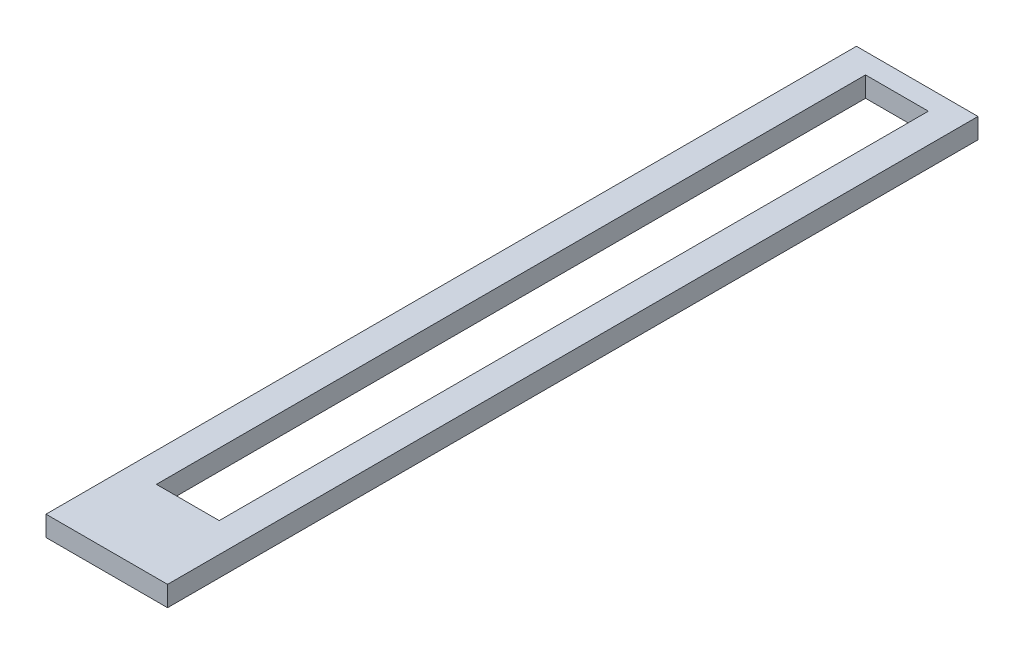
from build123d import *

# Parameters (mm, degrees)
ESBO_O1_W                = 30
ESBO_O1_H                = 200
RESSALTO_EXTRUS_O1_DEPTH = 5
ESBO_O2_W                = 15.5
ESBO_O2_H                = 175
CORTE_EXTRUS_O1_DEPTH    = 5


with BuildPart() as part:
    # Esboço1 → Ressalto-extrusão1 (new body)
    with BuildSketch(Plane(origin=(0, 0, 0), x_dir=(1, 0, 0), z_dir=(0, 1, 0))):
        Rectangle(ESBO_O1_W, ESBO_O1_H)
    extrude(amount=RESSALTO_EXTRUS_O1_DEPTH)

    # Esboço2 → Corte-extrusão1 (cut)
    with BuildSketch(Plane(origin=(0, 5, 0), x_dir=(1, 0, 0), z_dir=(0, 1, 0))):
        with Locations((0, 7.5)):
            Rectangle(ESBO_O2_W, ESBO_O2_H)
    extrude(amount=-CORTE_EXTRUS_O1_DEPTH, mode=Mode.SUBTRACT)


solid = part.part
